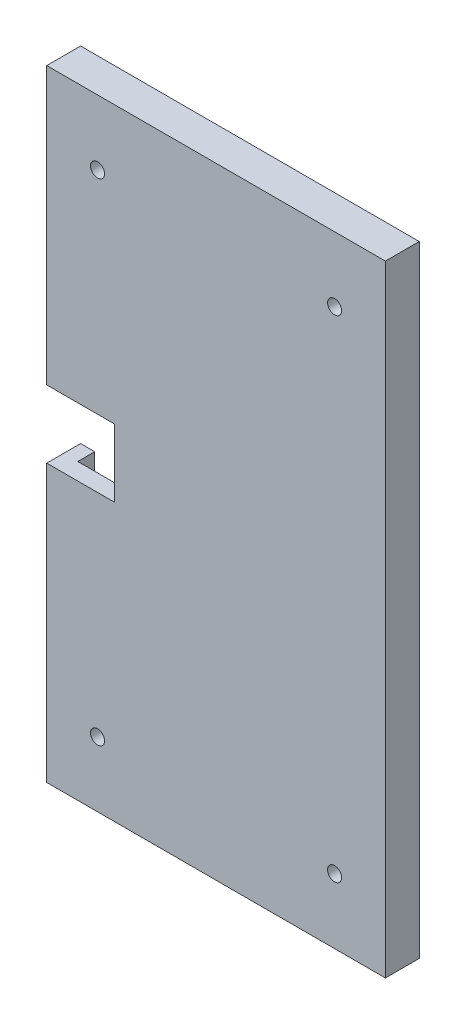
from build123d import *

# Parameters (mm, degrees)
SKETCH_1_W          = 60
SKETCH_1_H          = 110
SKETCH_1_W_2        = 50
SKETCH_1_H_2        = 100
SKETCH_1_R          = 1.25
EXTRUDE_1_DEPTH     = 6
SKETCH_3_W          = 5
SKETCH_3_H          = 12
SKETCH_3_W_2        = 50
SKETCH_3_H_2        = 100
SKETCH_3_R          = 1.25
CUT_EXTRUDE_2_DEPTH = 3
SKETCH_4_W          = 25
SKETCH_4_H          = 88
CUT_EXTRUDE_3_DEPTH = 2
SKETCH_5_W          = 12
SKETCH_5_H          = 12
CUT_EXTRUDE_4_DEPTH = 63.721607122
SKETCH_6_W          = 55
SKETCH_6_H          = 100
CUT_EXTRUDE_5_DEPTH = 63.721607122


with BuildPart() as part:
    # 草图1 → 凸台-拉伸1 (new body)
    # profile 1 of 2: a face of its own
    with BuildSketch(Plane.XY):
        Rectangle(SKETCH_1_W, SKETCH_1_H)
        Rectangle(SKETCH_1_W_2, SKETCH_1_H_2, mode=Mode.SUBTRACT)
    # profile 2 of 2: a face of its own
    with BuildSketch(Plane.XY):
        Rectangle(SKETCH_1_W_2, SKETCH_1_H_2)
        with Locations((21, -43.5)):
            Circle(SKETCH_1_R, mode=Mode.SUBTRACT)
        with Locations((-21, -43.5)):
            Circle(SKETCH_1_R, mode=Mode.SUBTRACT)
        with Locations((21, 43.5)):
            Circle(SKETCH_1_R, mode=Mode.SUBTRACT)
        with Locations((-21, 43.5)):
            Circle(SKETCH_1_R, mode=Mode.SUBTRACT)
    extrude(amount=EXTRUDE_1_DEPTH)

    # 草图3 → 切除-拉伸2 (cut)
    # profile 1 of 2: a face of its own
    with BuildSketch(Plane(origin=(0, 0, 0), x_dir=(-1, 0, 0), z_dir=(0, 0, -1))):
        with Locations((27.5, 0)):
            Rectangle(SKETCH_3_W, SKETCH_3_H)
    # profile 2 of 2: a face of its own
    with BuildSketch(Plane(origin=(0, 0, 0), x_dir=(-1, 0, 0), z_dir=(0, 0, -1))):
        Rectangle(SKETCH_3_W_2, SKETCH_3_H_2)
        with Locations((21, -43.5)):
            Circle(SKETCH_3_R, mode=Mode.SUBTRACT)
        with Locations((21, 43.5)):
            Circle(SKETCH_3_R, mode=Mode.SUBTRACT)
        with Locations((-21, 43.5)):
            Circle(SKETCH_3_R, mode=Mode.SUBTRACT)
        with Locations((-21, -43.5)):
            Circle(SKETCH_3_R, mode=Mode.SUBTRACT)
    extrude(amount=-CUT_EXTRUDE_2_DEPTH, mode=Mode.SUBTRACT)

    # 草图4 → 切除-拉伸3 (cut)
    with BuildSketch(Plane(origin=(0, 0, 3), x_dir=(-1, 0, 0), z_dir=(0, 0, -1))):
        with Locations((2.5, 0)):
            Rectangle(SKETCH_4_W, SKETCH_4_H)
    extrude(amount=-CUT_EXTRUDE_3_DEPTH, mode=Mode.SUBTRACT)

    # 草图5 → 切除-拉伸4 (cut, through all)
    with BuildSketch(Plane(origin=(0, 0, 3), x_dir=(-1, 0, 0), z_dir=(0, 0, -1))):
        with Locations((24, 0)):
            Rectangle(SKETCH_5_W, SKETCH_5_H)
    extrude(amount=-CUT_EXTRUDE_4_DEPTH, mode=Mode.SUBTRACT)

    # 草图6 → 切除-拉伸5 (cut, through all)
    with BuildSketch(Plane(origin=(0, 0, 3), x_dir=(-1, 0, 0), z_dir=(0, 0, -1))):
        Rectangle(SKETCH_6_W, SKETCH_6_H)
    extrude(amount=CUT_EXTRUDE_5_DEPTH, mode=Mode.SUBTRACT)


solid = part.part
